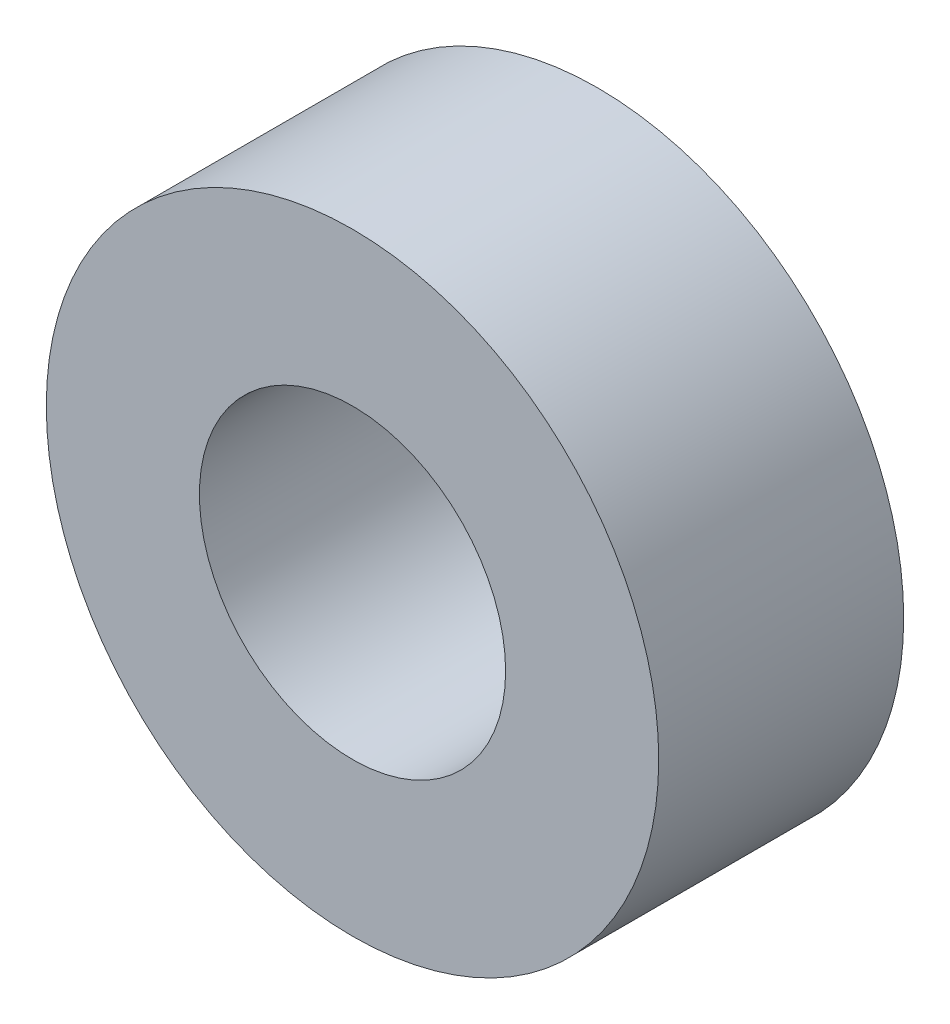
from build123d import *

# Parameters (mm, degrees)
SKETCH_1_R      = 5
SKETCH_1_R_2    = 2.5
EXTRUDE_1_DEPTH = 4


with BuildPart() as part:
    # 草图1 → 凸台-拉伸1 (new body)
    with BuildSketch(Plane.XY):
        Circle(SKETCH_1_R)
        Circle(SKETCH_1_R_2, mode=Mode.SUBTRACT)
    extrude(amount=EXTRUDE_1_DEPTH)


solid = part.part
